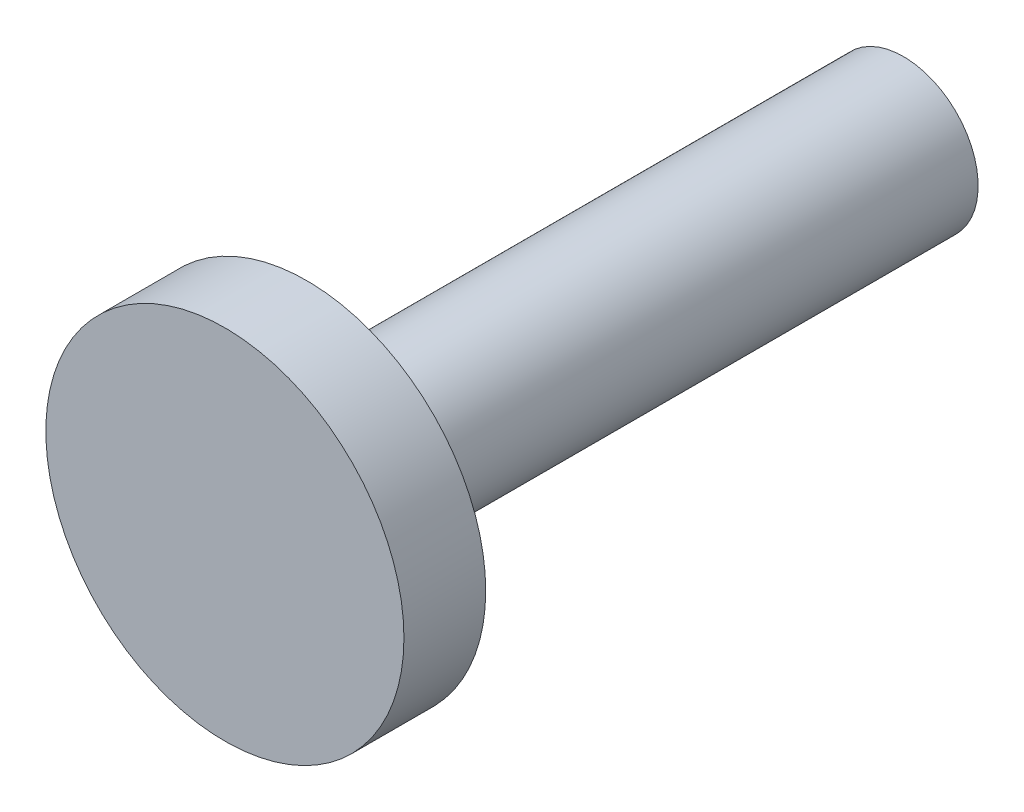
from build123d import *

# Parameters (mm, degrees)
ESQUISSE1_R        = 3
BOSS_EXTRU_1_DEPTH = 1.37
ESQUISSE2_R        = 1.25
BOSS_EXTRU_2_DEPTH = 10


with BuildPart() as part:
    # Esquisse1 → Boss.-Extru.1 (new body)
    with BuildSketch(Plane.XY):
        Circle(ESQUISSE1_R)
    extrude(amount=BOSS_EXTRU_1_DEPTH)

    # Esquisse2 → Boss.-Extru.2 (add)
    with BuildSketch(Plane(origin=(0, 0, 0), x_dir=(-1, 0, 0), z_dir=(0, 0, -1))):
        Circle(ESQUISSE2_R)
    extrude(amount=BOSS_EXTRU_2_DEPTH)


solid = part.part
